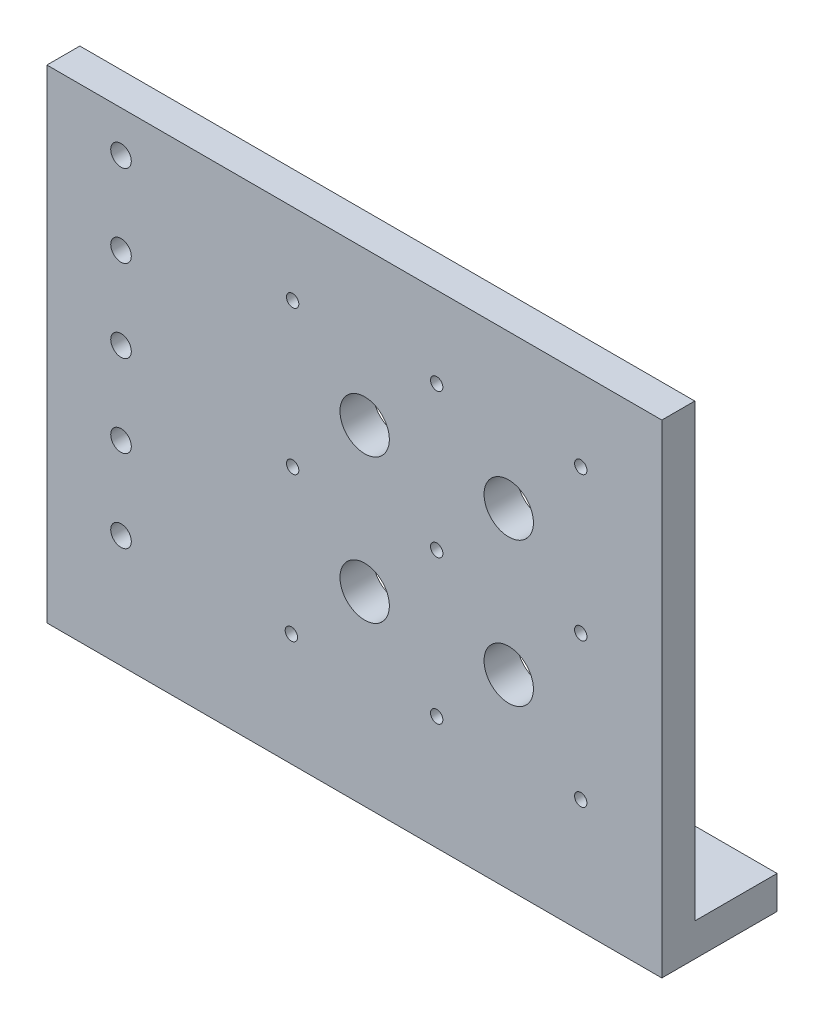
from build123d import *

# Parameters (mm, degrees)
SKETCH1_W           = 109.4
SKETCH1_H           = 109.4
SKETCH1_W_2         = 79.4
SKETCH1_H_2         = 79.4
SKETCH1_R           = 6
SKETCH1_R_2         = 1.5
BOSS_EXTRUDE1_DEPTH = 8
SKETCH2_W           = 40
SKETCH2_H           = 8
BOSS_EXTRUDE2_DEPTH = 109.4
SKETCH4_R           = 2.5
CUT_EXTRUDE1_DEPTH  = 25
SKETCH5_W           = 149.4
SKETCH5_H           = 8
SKETCH5_H_2         = 20
BOSS_EXTRUDE3_DEPTH = 8
CUT_EXTRUDE2_DEPTH  = 37
SKETCH7_R           = 2.5
CUT_EXTRUDE3_DEPTH  = 10


with BuildPart() as part:
    # Sketch1 → Boss-Extrude1 (new body)
    # profile 1 of 2: a face of its own
    with BuildSketch(Plane.XY):
        with Locations((-17.5, 17.5)):
            Rectangle(SKETCH1_W, SKETCH1_H)
        with Locations((-17.5, 17.5)):
            Rectangle(SKETCH1_W_2, SKETCH1_H_2, mode=Mode.SUBTRACT)
    # profile 2 of 2: a face of its own
    with BuildSketch(Plane.XY):
        with Locations((-17.5, 17.5)):
            Rectangle(SKETCH1_W_2, SKETCH1_H_2)
        with Locations((-35, 0)):
            Circle(SKETCH1_R, mode=Mode.SUBTRACT)
        Circle(SKETCH1_R, mode=Mode.SUBTRACT)
        with Locations((0, 35)):
            Circle(SKETCH1_R, mode=Mode.SUBTRACT)
        with Locations((-35, 35)):
            Circle(SKETCH1_R, mode=Mode.SUBTRACT)
        with Locations((-52.809903828, -17.809903828)):
            Circle(SKETCH1_R_2, mode=Mode.SUBTRACT)
        with Locations((-17.5, -17.5)):
            Circle(SKETCH1_R_2, mode=Mode.SUBTRACT)
        with Locations((17.5, -17.5)):
            Circle(SKETCH1_R_2, mode=Mode.SUBTRACT)
        with Locations((17.5, 17.5)):
            Circle(SKETCH1_R_2, mode=Mode.SUBTRACT)
        with Locations((-17.5, 17.5)):
            Circle(SKETCH1_R_2, mode=Mode.SUBTRACT)
        with Locations((-52.5, 17.5)):
            Circle(SKETCH1_R_2, mode=Mode.SUBTRACT)
        with Locations((17.5, 52.5)):
            Circle(SKETCH1_R_2, mode=Mode.SUBTRACT)
        with Locations((-17.5, 52.5)):
            Circle(SKETCH1_R_2, mode=Mode.SUBTRACT)
        with Locations((-52.5, 52.5)):
            Circle(SKETCH1_R_2, mode=Mode.SUBTRACT)
    extrude(amount=BOSS_EXTRUDE1_DEPTH)

    # Sketch2 → Boss-Extrude2 (add)
    with BuildSketch(Plane(origin=(0, 72.2, 0), x_dir=(1, 0, 0), z_dir=(0, 1, 0))):
        with Locations((-92.2, -4)):
            Rectangle(SKETCH2_W, SKETCH2_H)
    extrude(amount=-BOSS_EXTRUDE2_DEPTH)

    # Sketch4 → Cut-Extrude1 (cut)
    with BuildSketch(Plane(origin=(0, 0, 0), x_dir=(-1, 0, 0), z_dir=(0, 0, -1))):
        with Locations((94.2, 62.2)):
            Circle(SKETCH4_R)
        with Locations((94.2, 42.2)):
            Circle(SKETCH4_R)
        with Locations((94.2, 22.2)):
            Circle(SKETCH4_R)
        with Locations((94.2, 2.2)):
            Circle(SKETCH4_R)
        with Locations((94.2, -17.8)):
            Circle(SKETCH4_R)
    extrude(amount=-CUT_EXTRUDE1_DEPTH, mode=Mode.SUBTRACT)

    # Sketch5 → Boss-Extrude3 (add)
    with BuildSketch(Plane.XZ.offset(37.2)):
        with Locations((-37.5, 4)):
            Rectangle(SKETCH5_W, SKETCH5_H)
        with Locations((-37.5, -10)):
            Rectangle(SKETCH5_W, SKETCH5_H_2)
    extrude(amount=BOSS_EXTRUDE3_DEPTH)

    # Sketch6 → Cut-Extrude2 (cut)
    with BuildSketch(Plane(origin=(0, -37.2, 0), x_dir=(1, 0, 0), z_dir=(0, 1, 0))):
        Polygon((-112.2, 0), (-77.558983849, 20), (-112.2, 20), align=None)
    extrude(amount=-CUT_EXTRUDE2_DEPTH, mode=Mode.SUBTRACT)

    # Sketch7 → Cut-Extrude3 (cut)
    with BuildSketch(Plane(origin=(0, -37.2, 0), x_dir=(1, 0, 0), z_dir=(0, 1, 0))):
        with Locations(Location((22.2, 10, 0), (0, 0, 180))):
            Circle(SKETCH7_R)
        with Locations(Location((2.2, 10, 0), (0, 0, 180))):
            Circle(SKETCH7_R)
        with Locations(Location((-17.8, 10, 0), (0, 0, 180))):
            Circle(SKETCH7_R)
        with Locations(Location((-37.8, 10, 0), (0, 0, 180))):
            Circle(SKETCH7_R)
        with Locations(Location((-57.8, 10, 0), (0, 0, 180))):
            Circle(SKETCH7_R)
        with Locations(Location((-77.8, 10, 0), (0, 0, 180))):
            Circle(SKETCH7_R)
    extrude(amount=-CUT_EXTRUDE3_DEPTH, mode=Mode.SUBTRACT)


solid = part.part
